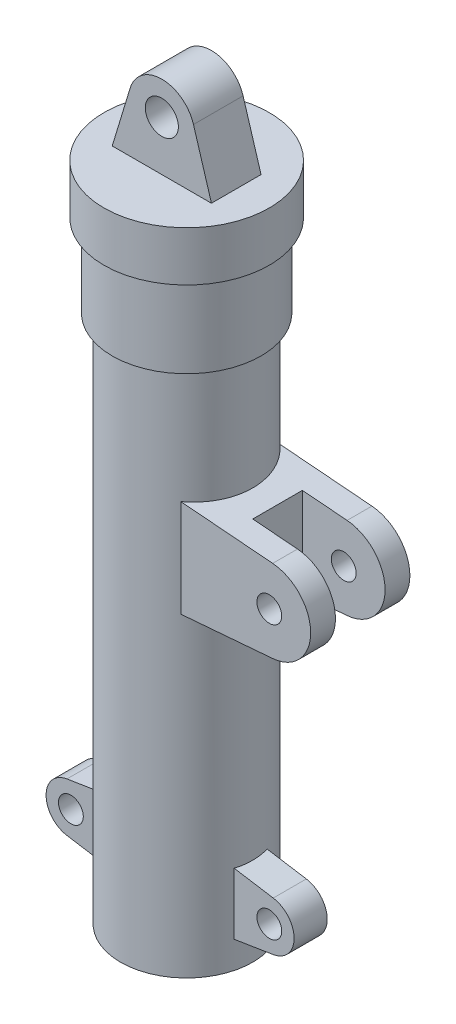
from build123d import *

# Parameters (mm, degrees)
SKETCH2_R           = 10
BOSS_EXTRUDE1_DEPTH = 15
SKETCH3_R           = 7.5
BOSS_EXTRUDE2_DEPTH = 10
SKETCH8_R           = 7.5
BOSS_EXTRUDE3_DEPTH = 30
SKETCH4_W           = 35
SKETCH4_H           = 315
SKETCH9_W           = 70
SKETCH9_H           = 80
CUT_EXTRUDE1_DEPTH  = 15


with BuildPart() as part:
    # Sketch1 → Base-Revolve (revolve)
    with BuildSketch(Plane.XY, mode=Mode.PRIVATE) as base_revolve_sk:
        Polygon((22.5, -330), (40, -330), (40, -10), (45, -10), (45, 40), (50, 40), (50, 70), (0, 70), (0, 55), (35, 55), (35, -325), (22.5, -325), align=None)
    revolve(base_revolve_sk.sketch.rotate(Axis((0, 100, 0), (0, -1, 0)), 90), axis=Axis((0, 100, 0), (0, -1, 0)))

    # Sketch2 → Boss-Extrude1 (add, symmetric)
    with BuildSketch(Plane.XY):
        with BuildLine():
            Line((19.138857956, 105.805524623), (30, 70))
            Line((30, 70), (-30, 70))
            Line((-30, 70), (-19.138857956, 105.805524623))
            ThreePointArc((-19.138857956, 105.805524623), (0, 120), (19.138857956, 105.805524623))
        make_face()
        with Locations((0, 100)):
            Circle(SKETCH2_R, mode=Mode.SUBTRACT)
    extrude(amount=BOSS_EXTRUDE1_DEPTH, both=True)

    # Sketch3 → Boss-Extrude2 (add, symmetric)
    with BuildSketch(Plane.XY):
        with BuildLine():
            Line((62.373967528, -280.189048708), (30, -275))
            Line((30, -275), (30, -315))
            Line((30, -315), (62.373967528, -309.810951292))
            ThreePointArc((62.373967528, -309.810951292), (75, -295), (62.373967528, -280.189048708))
        make_face()
        with Locations((60, -295)):
            Circle(SKETCH3_R, mode=Mode.SUBTRACT)
    boss_extrude2 = extrude(amount=BOSS_EXTRUDE2_DEPTH, both=True)

    # Mirror1: Boss-Extrude2 across plane
    add(boss_extrude2.mirror(Plane(origin=(0, 0, 0), x_dir=(0, 0, 1), z_dir=(1, 0, 0))))

    # Sketch8 → Boss-Extrude3 (add, symmetric)
    with BuildSketch(Plane.XY):
        with BuildLine():
            Line((82.041582998, -85.08350067), (20, -80))
            Line((20, -80), (20, -140))
            Line((20, -140), (82.041582998, -134.91649933))
            ThreePointArc((82.041582998, -134.91649933), (105, -110), (82.041582998, -85.08350067))
        make_face()
        with Locations(Location((80, -110, 0), (0, 0, 180))):
            Circle(SKETCH8_R, mode=Mode.SUBTRACT)
    extrude(amount=BOSS_EXTRUDE3_DEPTH, both=True)

    # Sketch4 → Cut-Revolve1 (revolve, cut)
    with BuildSketch(Plane.XY):
        with Locations((17.5, -167.5)):
            Rectangle(SKETCH4_W, SKETCH4_H)
    revolve(axis=Axis((0, 0, 0), (0, -1, 0)), mode=Mode.SUBTRACT)

    # Sketch9 → Cut-Extrude1 (cut, symmetric)
    with BuildSketch(Plane.XY):
        with Locations((90, -110)):
            Rectangle(SKETCH9_W, SKETCH9_H)
    extrude(amount=CUT_EXTRUDE1_DEPTH, both=True, mode=Mode.SUBTRACT)


solid = part.part
